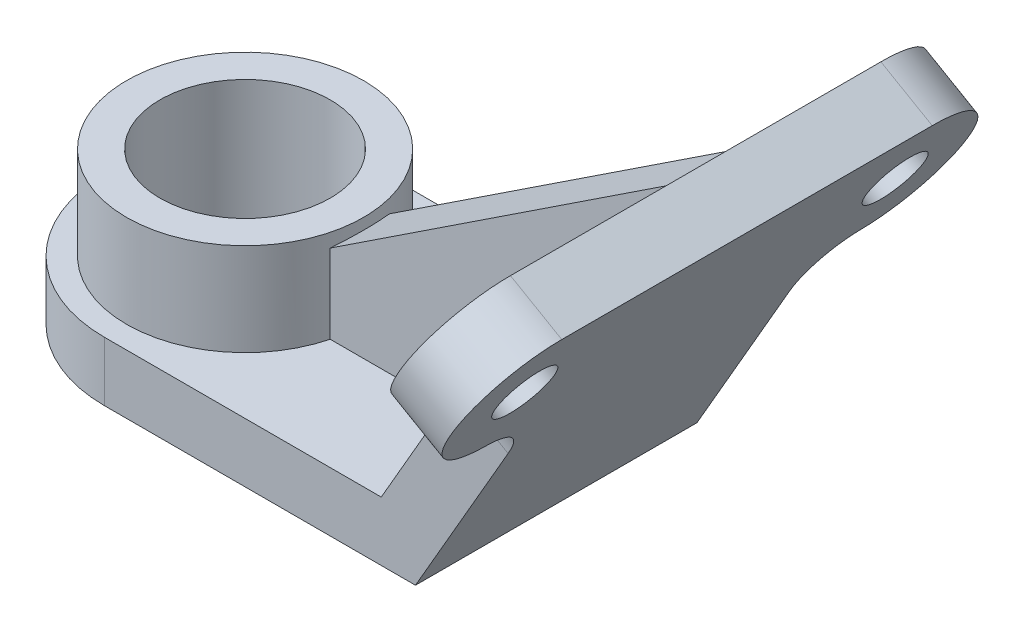
from build123d import *
from build123d.topology import SkipClean

# Parameters (mm, degrees)
EXTRUDE_1_DEPTH     = 38
SKETCH_3_R          = 8
EXTRUDE_2_DEPTH     = 16
EXTRUDE_3_DEPTH     = 25
CUT_EXTRUDE_1_REACH = 205.95
SKETCH_5_4_R        = 23
CUT_EXTRUDE_2_REACH = 205.95
RIB_1_REACH         = 212.832
SKETCH_9_WALL_W     = 531.09195721
SKETCH_9_WALL_H     = 16


with BuildPart() as part:
    # 草图1 → 凸台-拉伸1 (new, symmetric)
    with BuildSketch(Plane.XY):
        Polygon((0, 0), (122, 0), (173.5, 89.20061659), (159.643593539, 97.20061659), (112.762395693, 16), (0, 16), align=None)
    extrude(amount=EXTRUDE_1_DEPTH, both=True)

    # 草图3 → 凸台-拉伸2 (add)
    # profile 1 of 2: a face of its own
    with BuildSketch(Plane(origin=(77.643593539, -44.827549631, 0), x_dir=(0, 0, 1), z_dir=(-0.86602540378444, 0.49999999999999784, 0))):
        with BuildLine():
            Line((-38, 164), (-50, 164))
            ThreePointArc((-50, 164), (-69.997703657, 144.3030651), (-50.606060606, 124.009184845))
            ThreePointArc((-50.606060606, 124.009184845), (-41.669372687, 120.067193105), (-38, 111.015154995))
            Line((-38, 111.015154995), (-38, 164))
        make_face()
        with Locations(Location((-50, 144, 0), (0, 0, 270))):
            Circle(SKETCH_3_R, mode=Mode.SUBTRACT)
    # profile 2 of 2: a face of its own
    with BuildSketch(Plane(origin=(77.643593539, -44.827549631, 0), x_dir=(0, 0, 1), z_dir=(-0.86602540378444, 0.49999999999999784, 0))):
        with BuildLine():
            Line((50, 164), (38, 164))
            Line((38, 164), (38, 111.015154995))
            ThreePointArc((38, 111.015154995), (41.669372687, 120.067193105), (50.606060606, 124.009184845))
            ThreePointArc((50.606060606, 124.009184845), (69.997703657, 144.3030651), (50, 164))
        make_face()
        with Locations(Location((50, 144, 0), (0, 0, 270))):
            Circle(SKETCH_3_R, mode=Mode.SUBTRACT)
    extrude(amount=-EXTRUDE_2_DEPTH)

    # 草图5 → 凸台-拉伸3 (add)
    with BuildSketch(Plane(origin=(0, 16, 0), x_dir=(1, 0, 0), z_dir=(0, 1, 0))):
        with BuildLine():
            ThreePointArc((15, 0), (38, 23), (61, 0))
            Line((61, 0), (70, 0))
            ThreePointArc((70, 0), (38, 32), (6, 0))
            Line((6, 0), (15, 0))
        make_face()
        with BuildLine():
            Line((70, 0), (61, 0))
            ThreePointArc((61, 0), (38, -23), (15, 0))
            Line((15, 0), (6, 0))
            ThreePointArc((6, 0), (38, -32), (70, 0))
        make_face()
    extrude(amount=EXTRUDE_3_DEPTH)

    # 草图5<4> → 切除-拉伸1 (cut, up to next)
    with BuildSketch(Plane(origin=(0, 16, 0), x_dir=(1, 0, 0), z_dir=(0, 1, 0)), mode=Mode.PRIVATE) as cut_extrude_1_sk1:
        with Locations(Location((38, 0, 0), (0, 0, 270))):
            Circle(SKETCH_5_4_R)
    cut_extrude_1_tool1 = extrude(cut_extrude_1_sk1.sketch, amount=-CUT_EXTRUDE_1_REACH, mode=Mode.PRIVATE) & part.part
    add(cut_extrude_1_tool1.solids().sort_by_distance((38, 16, 0))[0], mode=Mode.SUBTRACT)

    # 草图6 → 切除-拉伸2 (cut, up to next)
    with BuildSketch(Plane(origin=(0, 16, 0), x_dir=(1, 0, 0), z_dir=(0, 1, 0)), mode=Mode.PRIVATE) as cut_extrude_2_sk1:
        with BuildLine():
            Line((38, 38), (0, 38))
            Line((0, 38), (0, 0))
            ThreePointArc((0, 0), (11.129942315, 26.870057685), (38, 38))
        make_face()
    cut_extrude_2_tool1 = extrude(cut_extrude_2_sk1.sketch, amount=-CUT_EXTRUDE_2_REACH, mode=Mode.PRIVATE) & part.part
    cut_extrude_2 = cut_extrude_2_tool1.solids().sort_by_distance((8.487982, 16, -29.512018))[0]
    add(cut_extrude_2, mode=Mode.SUBTRACT)

    # 镜向1: 切除-拉伸2 across plane
    with SkipClean():  # the faces are left unmerged after this step: merging them gives an invalid solid
        add(cut_extrude_2.mirror(Plane.XY), mode=Mode.SUBTRACT)

    # 草图9 wall → 筋1 (add, up to next)
    with BuildSketch(Plane(origin=(114.821796769, 67.600308295, 0), x_dir=(0.834455975571, 0.551074609136, 0), z_dir=(-0.551074609136, 0.834455975571, 0)), mode=Mode.PRIVATE) as rib_1_sk1:
        Rectangle(SKETCH_9_WALL_W, SKETCH_9_WALL_H)
    rib_1_tool1 = extrude(rib_1_sk1.sketch, amount=-RIB_1_REACH, mode=Mode.PRIVATE) - part.part
    add(rib_1_tool1.solids().sort_by_distance((114.821796769, 67.600308295, 0))[0])


solid = part.part
